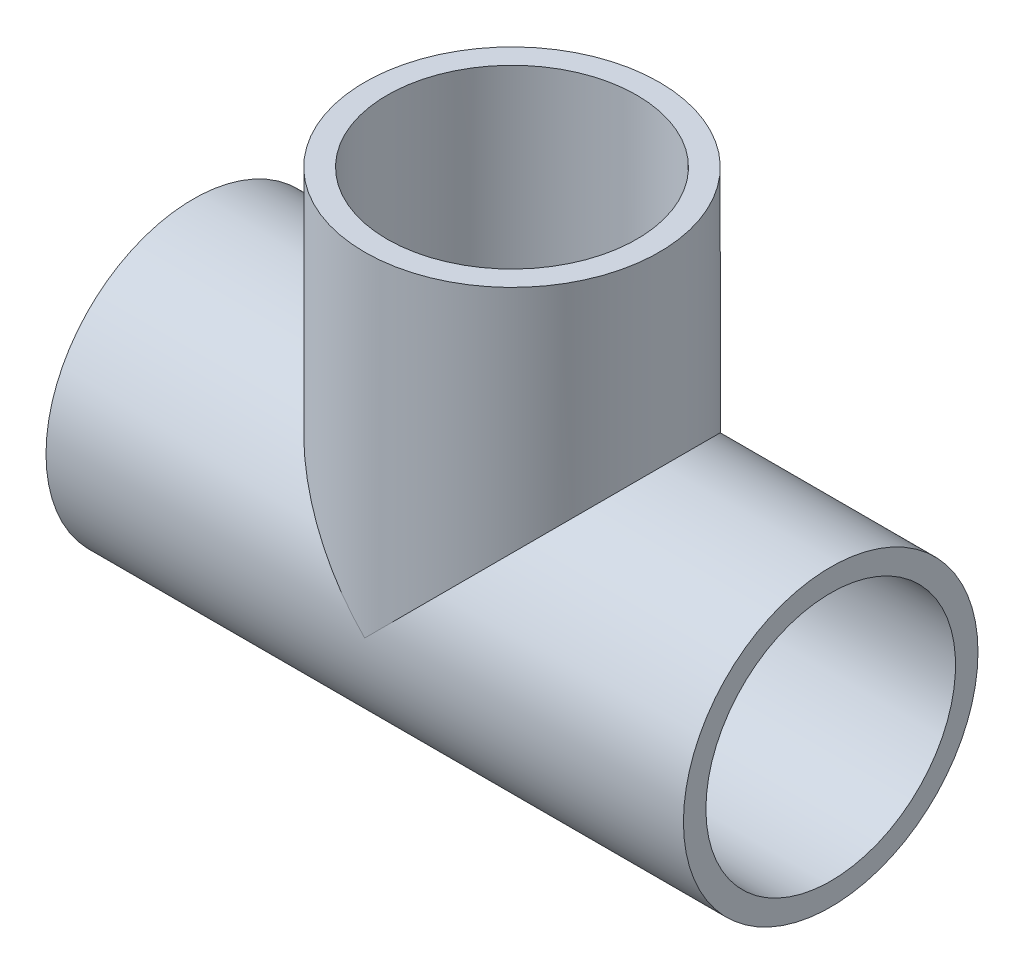
from build123d import *
from build123d.topology import SkipClean

# Parameters (mm, degrees)
CROQUIS1_R              = 52.45
CROQUIS1_R_2            = 44.45
SALIENTE_EXTRUIR1_DEPTH = 227
CROQUIS2_R              = 52.45
CROQUIS2_R_2            = 44.45
SALIENTE_EXTRUIR2_DEPTH = 119
CROQUIS3_R              = 44.45
CORTAR_EXTRUIR1_DEPTH   = 227


with BuildPart() as part:
    # Croquis1 → Saliente-Extruir1 (new body)
    with BuildSketch(Plane(origin=(0, 0, 0), x_dir=(0, 0, -1), z_dir=(1, 0, 0))):
        with Locations(Location((0, 0, 0), (0, 0, 180))):
            Circle(CROQUIS1_R)
        with Locations(Location((0, 0, 0), (0, 0, 180))):
            Circle(CROQUIS1_R_2, mode=Mode.SUBTRACT)
    extrude(amount=SALIENTE_EXTRUIR1_DEPTH)

    # Croquis2 → Saliente-Extruir2 (add)
    with BuildSketch(Plane(origin=(0, 0, 0), x_dir=(1, 0, 0), z_dir=(0, 1, 0))):
        with Locations(Location((113.5, 0, 0), (0, 0, 270))):
            Circle(CROQUIS2_R)
        with Locations(Location((113.5, 0, 0), (0, 0, 90))):
            Circle(CROQUIS2_R_2, mode=Mode.SUBTRACT)
    extrude(amount=SALIENTE_EXTRUIR2_DEPTH)

    # Croquis3 → Cortar-Extruir1 (cut)
    with SkipClean():  # the faces are left unmerged after this step: merging them gives an invalid solid
        with BuildSketch(Plane.ZY):
            Circle(CROQUIS3_R)
        extrude(amount=-CORTAR_EXTRUIR1_DEPTH, mode=Mode.SUBTRACT)


solid = part.part
